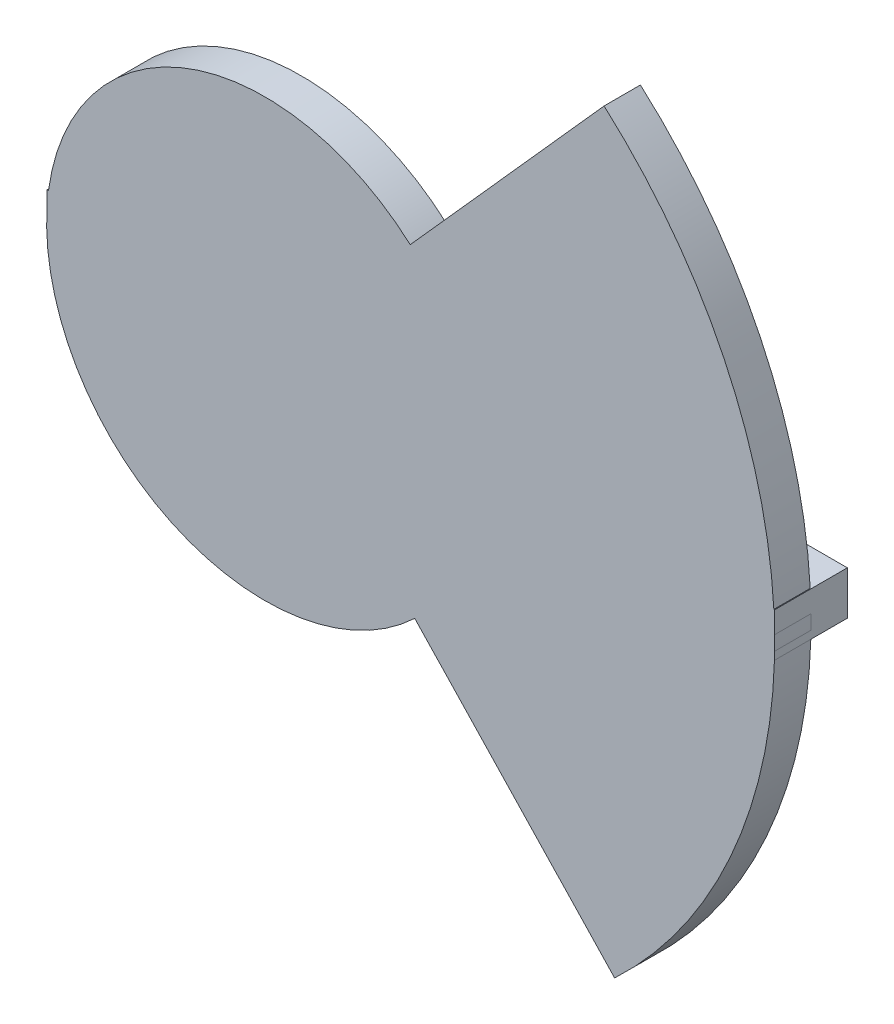
from build123d import *

# Parameters (mm, degrees)
SKETCH3_R           = 20
SKETCH3_W           = 100
SKETCH3_H           = 6
BOSS_EXTRUDE3_DEPTH = 10
SKETCH5_R           = 30
BOSS_EXTRUDE4_DEPTH = 5


with BuildPart() as part:
    # Sketch3 → Boss-Extrude3 (new body)
    with BuildSketch(Plane.XY):
        with Locations((-20.605993479, -1.21989897)):
            Circle(SKETCH3_R)
        with Locations((-0.535964706, -0.268513697)):
            Rectangle(SKETCH3_W, SKETCH3_H)
    extrude(amount=-BOSS_EXTRUDE3_DEPTH)

    # Sketch5 → Boss-Extrude4 (add)
    with BuildSketch(Plane.XY):
        with BuildLine():
            Line((26.021713598, 50.989840857), (-0.622690446, 21.155703813))
            ThreePointArc((-0.622690446, 21.155703813), (6.775561362, 11.037770242), (9.394006521, -1.21989897))
            ThreePointArc((9.394006521, -1.21989897), (6.945592722, -13.090454889), (0, -23.023408613))
            Line((0, -23.023408613), (27.474657971, -52.094754804))
            ThreePointArc((27.474657971, -52.094754804), (49.464035294, -0.232284347), (26.021713598, 50.989840857))
        make_face()
        with Locations((-20.605993479, -1.21989897)):
            Circle(SKETCH5_R)
    extrude(amount=-BOSS_EXTRUDE4_DEPTH)


solid = part.part
